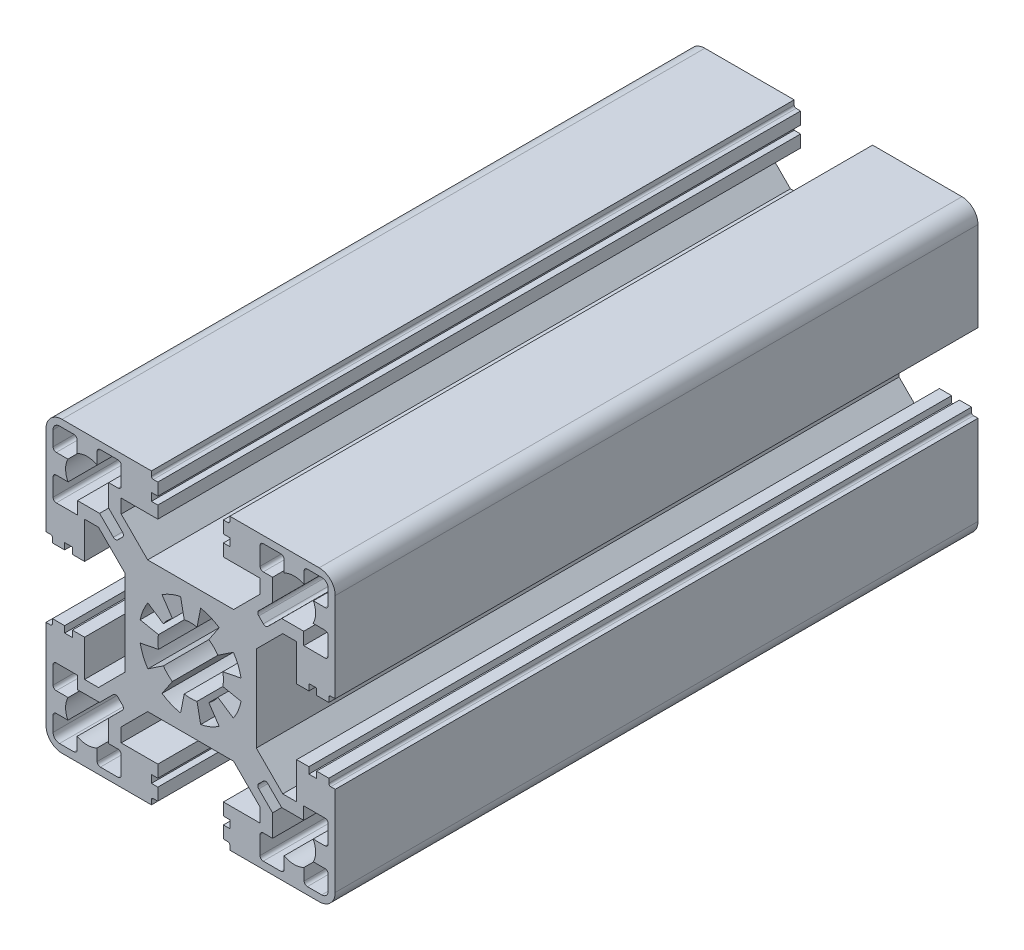
from build123d import *

# Parameters (mm, degrees)
EXTRUDE_1_DEPTH = 100


with BuildPart() as part:
    # 草图1 → 凸台-拉伸1 (new body)
    with BuildSketch(Plane.XY):
        with BuildLine():
            Line((-5.371587854, 23.257012623), (-19.271587854, 23.257012623))
            ThreePointArc((-19.271587854, 23.257012623), (-21.039354807, 22.524779576), (-21.771587854, 20.757012623))
            Line((-21.771587854, 20.757012623), (-21.771587854, 6.857012623))
            Line((-21.771587854, 6.857012623), (-21.071587854, 6.857012623))
            ThreePointArc((-21.071587854, 6.857012623), (-20.85945582, 6.769144657), (-20.771587854, 6.557012623))
            Line((-20.771587854, 6.557012623), (-20.771587854, 5.857012623))
            Line((-20.771587854, 5.857012623), (-18.871587854, 5.857012623))
            Line((-18.871587854, 5.857012623), (-18.871587854, 6.857012623))
            Line((-18.871587854, 6.857012623), (-17.671587854, 6.857012623))
            Line((-17.671587854, 6.857012623), (-17.671587854, 5.857012623))
            Line((-17.671587854, 5.857012623), (-15.771587854, 5.857012623))
            Line((-15.771587854, 5.857012623), (-15.771587854, 11.557012623))
            Line((-15.771587854, 11.557012623), (-13.60712176, 11.557012623))
            Line((-13.60712176, 11.557012623), (-9.491587854, 7.441478717))
            Line((-9.491587854, 7.441478717), (-9.491587854, -5.927453471))
            Line((-9.491587854, -5.927453471), (-13.60712176, -10.042987377))
            Line((-13.60712176, -10.042987377), (-15.771587854, -10.042987377))
            Line((-15.771587854, -10.042987377), (-15.771587854, -4.342987377))
            Line((-15.771587854, -4.342987377), (-17.671587854, -4.342987377))
            Line((-17.671587854, -4.342987377), (-17.671587854, -5.342987377))
            Line((-17.671587854, -5.342987377), (-18.871587854, -5.342987377))
            Line((-18.871587854, -5.342987377), (-18.871587854, -4.342987377))
            Line((-18.871587854, -4.342987377), (-20.771587854, -4.342987377))
            Line((-20.771587854, -4.342987377), (-20.771587854, -5.042987377))
            ThreePointArc((-20.771587854, -5.042987377), (-20.85945582, -5.255119412), (-21.071587854, -5.342987377))
            Line((-21.071587854, -5.342987377), (-21.771587854, -5.342987377))
            Line((-21.771587854, -5.342987377), (-21.771587854, -19.242987377))
            ThreePointArc((-21.771587854, -19.242987377), (-21.039354807, -21.01075433), (-19.271587854, -21.742987377))
            Line((-19.271587854, -21.742987377), (-5.371587854, -21.742987377))
            Line((-5.371587854, -21.742987377), (-5.371587854, -21.042987377))
            ThreePointArc((-5.371587854, -21.042987377), (-5.283719889, -20.830855343), (-5.071587854, -20.742987377))
            Line((-5.071587854, -20.742987377), (-4.371587854, -20.742987377))
            Line((-4.371587854, -20.742987377), (-4.371587854, -18.842987377))
            Line((-4.371587854, -18.842987377), (-5.371587854, -18.842987377))
            Line((-5.371587854, -18.842987377), (-5.371587854, -17.642987377))
            Line((-5.371587854, -17.642987377), (-4.371587854, -17.642987377))
            Line((-4.371587854, -17.642987377), (-4.371587854, -15.742987377))
            Line((-4.371587854, -15.742987377), (-10.071587854, -15.742987377))
            Line((-10.071587854, -15.742987377), (-10.071587854, -13.578521283))
            Line((-10.071587854, -13.578521283), (-5.956053948, -9.462987377))
            Line((-5.956053948, -9.462987377), (7.41287824, -9.462987377))
            Line((7.41287824, -9.462987377), (11.528412146, -13.578521283))
            Line((11.528412146, -13.578521283), (11.528412146, -15.742987377))
            Line((11.528412146, -15.742987377), (5.828412146, -15.742987377))
            Line((5.828412146, -15.742987377), (5.828412146, -17.642987377))
            Line((5.828412146, -17.642987377), (6.828412146, -17.642987377))
            Line((6.828412146, -17.642987377), (6.828412146, -18.842987377))
            Line((6.828412146, -18.842987377), (5.828412146, -18.842987377))
            Line((5.828412146, -18.842987377), (5.828412146, -20.742987377))
            Line((5.828412146, -20.742987377), (6.528412146, -20.742987377))
            ThreePointArc((6.528412146, -20.742987377), (6.74054418, -20.830855343), (6.828412146, -21.042987377))
            Line((6.828412146, -21.042987377), (6.828412146, -21.742987377))
            Line((6.828412146, -21.742987377), (20.728412146, -21.742987377))
            ThreePointArc((20.728412146, -21.742987377), (22.496179099, -21.01075433), (23.228412146, -19.242987377))
            Line((23.228412146, -19.242987377), (23.228412146, -5.342987377))
            Line((23.228412146, -5.342987377), (22.528412146, -5.342987377))
            ThreePointArc((22.528412146, -5.342987377), (22.316280111, -5.255119412), (22.228412146, -5.042987377))
            Line((22.228412146, -5.042987377), (22.228412146, -4.342987377))
            Line((22.228412146, -4.342987377), (20.328412146, -4.342987377))
            Line((20.328412146, -4.342987377), (20.328412146, -5.342987377))
            Line((20.328412146, -5.342987377), (19.128412146, -5.342987377))
            Line((19.128412146, -5.342987377), (19.128412146, -4.342987377))
            Line((19.128412146, -4.342987377), (17.228412146, -4.342987377))
            Line((17.228412146, -4.342987377), (17.228412146, -10.042987377))
            Line((17.228412146, -10.042987377), (15.063946052, -10.042987377))
            Line((15.063946052, -10.042987377), (10.948412146, -5.927453471))
            Line((10.948412146, -5.927453471), (10.948412146, 7.441478717))
            Line((10.948412146, 7.441478717), (15.063946052, 11.557012623))
            Line((15.063946052, 11.557012623), (17.228412146, 11.557012623))
            Line((17.228412146, 11.557012623), (17.228412146, 5.857012623))
            Line((17.228412146, 5.857012623), (19.128412146, 5.857012623))
            Line((19.128412146, 5.857012623), (19.128412146, 6.857012623))
            Line((19.128412146, 6.857012623), (20.328412146, 6.857012623))
            Line((20.328412146, 6.857012623), (20.328412146, 5.857012623))
            Line((20.328412146, 5.857012623), (22.228412146, 5.857012623))
            Line((22.228412146, 5.857012623), (22.228412146, 6.557012623))
            ThreePointArc((22.228412146, 6.557012623), (22.316280111, 6.769144657), (22.528412146, 6.857012623))
            Line((22.528412146, 6.857012623), (23.228412146, 6.857012623))
            Line((23.228412146, 6.857012623), (23.228412146, 20.757012623))
            ThreePointArc((23.228412146, 20.757012623), (22.496179099, 22.524779576), (20.728412146, 23.257012623))
            Line((20.728412146, 23.257012623), (6.828412146, 23.257012623))
            Line((6.828412146, 23.257012623), (6.828412146, 22.557012623))
            ThreePointArc((6.828412146, 22.557012623), (6.74054418, 22.344880588), (6.528412146, 22.257012623))
            Line((6.528412146, 22.257012623), (5.828412146, 22.257012623))
            Line((5.828412146, 22.257012623), (5.828412146, 20.357012623))
            Line((5.828412146, 20.357012623), (6.828412146, 20.357012623))
            Line((6.828412146, 20.357012623), (6.828412146, 19.157012623))
            Line((6.828412146, 19.157012623), (5.828412146, 19.157012623))
            Line((5.828412146, 19.157012623), (5.828412146, 17.257012623))
            Line((5.828412146, 17.257012623), (11.528412146, 17.257012623))
            Line((11.528412146, 17.257012623), (11.528412146, 15.092546529))
            Line((11.528412146, 15.092546529), (7.41287824, 10.977012623))
            Line((7.41287824, 10.977012623), (-5.956053948, 10.977012623))
            Line((-5.956053948, 10.977012623), (-10.071587854, 15.092546529))
            Line((-10.071587854, 15.092546529), (-10.071587854, 17.257012623))
            Line((-10.071587854, 17.257012623), (-4.371587854, 17.257012623))
            Line((-4.371587854, 17.257012623), (-4.371587854, 19.157012623))
            Line((-4.371587854, 19.157012623), (-5.371587854, 19.157012623))
            Line((-5.371587854, 19.157012623), (-5.371587854, 20.357012623))
            Line((-5.371587854, 20.357012623), (-4.371587854, 20.357012623))
            Line((-4.371587854, 20.357012623), (-4.371587854, 22.257012623))
            Line((-4.371587854, 22.257012623), (-5.071587854, 22.257012623))
            ThreePointArc((-5.071587854, 22.257012623), (-5.283719889, 22.344880588), (-5.371587854, 22.557012623))
            Line((-5.371587854, 22.557012623), (-5.371587854, 23.257012623))
        make_face()
        with BuildLine():
            Line((-3.716149718, -5.894744276), (-2.104996043, -3.4834824))
            ThreePointArc((-2.104996043, -3.4834824), (-2.877832438, -2.849231961), (-3.512082877, -2.076395566))
            Line((-3.512082877, -2.076395566), (-5.923344753, -3.687549241))
            ThreePointArc((-5.923344753, -3.687549241), (-6.662624114, -2.304454836), (-7.117870097, -0.803709953))
            Line((-7.117870097, -0.803709953), (-4.273592784, -0.23794802))
            ThreePointArc((-4.273592784, -0.23794802), (-4.371587854, 0.757012623), (-4.273592784, 1.751973265))
            Line((-4.273592784, 1.751973265), (-7.117870097, 2.317735199))
            ThreePointArc((-7.117870097, 2.317735199), (-6.662624114, 3.818480082), (-5.923344753, 5.201574487))
            Line((-5.923344753, 5.201574487), (-3.512082877, 3.590420811))
            ThreePointArc((-3.512082877, 3.590420811), (-2.877832438, 4.363257207), (-2.104996043, 4.997507645))
            Line((-2.104996043, 4.997507645), (-3.716149718, 7.408769521))
            ThreePointArc((-3.716149718, 7.408769521), (-2.333055313, 8.148048883), (-0.83231043, 8.603294866))
            Line((-0.83231043, 8.603294866), (-0.266548496, 5.759017553))
            ThreePointArc((-0.266548496, 5.759017553), (0.728412146, 5.857012623), (1.723372788, 5.759017553))
            Line((1.723372788, 5.759017553), (2.289134722, 8.603294866))
            ThreePointArc((2.289134722, 8.603294866), (3.789879605, 8.148048883), (5.17297401, 7.408769521))
            Line((5.17297401, 7.408769521), (3.561820334, 4.997507645))
            ThreePointArc((3.561820334, 4.997507645), (4.33465673, 4.363257207), (4.968907169, 3.590420811))
            Line((4.968907169, 3.590420811), (7.380169044, 5.201574487))
            ThreePointArc((7.380169044, 5.201574487), (8.119448406, 3.818480082), (8.574694389, 2.317735199))
            Line((8.574694389, 2.317735199), (5.730417076, 1.751973265))
            ThreePointArc((5.730417076, 1.751973265), (5.828412146, 0.757012623), (5.730417076, -0.23794802))
            Line((5.730417076, -0.23794802), (8.574694389, -0.803709953))
            ThreePointArc((8.574694389, -0.803709953), (8.119448406, -2.304454836), (7.380169044, -3.687549241))
            Line((7.380169044, -3.687549241), (4.968907169, -2.076395566))
            ThreePointArc((4.968907169, -2.076395566), (4.33465673, -2.849231961), (3.561820334, -3.4834824))
            Line((3.561820334, -3.4834824), (5.17297401, -5.894744276))
            ThreePointArc((5.17297401, -5.894744276), (3.789879605, -6.634023637), (2.289134722, -7.089269621))
            Line((2.289134722, -7.089269621), (1.723372788, -4.244992307))
            ThreePointArc((1.723372788, -4.244992307), (0.728412146, -4.342987377), (-0.266548496, -4.244992307))
            Line((-0.266548496, -4.244992307), (-0.83231043, -7.089269621))
            ThreePointArc((-0.83231043, -7.089269621), (-2.333055313, -6.634023637), (-3.716149718, -5.894744276))
        make_face(mode=Mode.SUBTRACT)
        with BuildLine():
            Line((-20.671587854, 21.157012623), (-20.671587854, 18.857012623))
            ThreePointArc((-20.671587854, 18.857012623), (-20.525141245, 18.503459232), (-20.171587854, 18.357012623))
            Line((-20.171587854, 18.357012623), (-18.367001014, 18.357012623))
            ThreePointArc((-18.367001014, 18.357012623), (-18.721418112, 16.823289618), (-18.336195754, 15.297012623))
            Line((-18.336195754, 15.297012623), (-20.171587854, 15.297012623))
            ThreePointArc((-20.171587854, 15.297012623), (-20.525141245, 15.150566013), (-20.671587854, 14.797012623))
            Line((-20.671587854, 14.797012623), (-20.671587854, 12.057012623))
            ThreePointArc((-20.671587854, 12.057012623), (-20.525141245, 11.703459232), (-20.171587854, 11.557012623))
            Line((-20.171587854, 11.557012623), (-16.871587854, 11.557012623))
            Line((-16.871587854, 11.557012623), (-16.871587854, 13.507012623))
            Line((-16.871587854, 13.507012623), (-13.435801417, 13.507012623))
            Line((-13.435801417, 13.507012623), (-11.292403135, 11.363614341))
            ThreePointArc((-11.292403135, 11.363614341), (-10.938849744, 11.217167731), (-10.585296353, 11.363614342))
            Line((-10.585296353, 11.363614342), (-9.878189571, 12.070721124))
            ThreePointArc((-9.878189571, 12.070721124), (-9.731742961, 12.424274514), (-9.878189571, 12.777827905))
            Line((-9.878189571, 12.777827905), (-12.021587851, 14.921226185))
            Line((-12.021587851, 14.921226185), (-12.021587851, 18.357012623))
            Line((-12.021587851, 18.357012623), (-10.571587854, 18.357012623))
            ThreePointArc((-10.571587854, 18.357012623), (-10.218034464, 18.503459232), (-10.071587854, 18.857012623))
            Line((-10.071587854, 18.857012623), (-10.071587854, 21.657012623))
            ThreePointArc((-10.071587854, 21.657012623), (-10.218034464, 22.010566013), (-10.571587854, 22.157012623))
            Line((-10.571587854, 22.157012623), (-13.311587854, 22.157012623))
            ThreePointArc((-13.311587854, 22.157012623), (-13.665141245, 22.010566013), (-13.811587854, 21.657012623))
            Line((-13.811587854, 21.657012623), (-13.811587854, 19.821620523))
            ThreePointArc((-13.811587854, 19.821620523), (-15.371587854, 20.207012623), (-16.931587854, 19.821620523))
            Line((-16.931587854, 19.821620523), (-16.931587854, 21.657012623))
            ThreePointArc((-16.931587854, 21.657012623), (-17.078034464, 22.010566013), (-17.431587854, 22.157012623))
            Line((-17.431587854, 22.157012623), (-19.671587854, 22.157012623))
            ThreePointArc((-19.671587854, 22.157012623), (-20.378694635, 21.864119404), (-20.671587854, 21.157012623))
        make_face(mode=Mode.SUBTRACT)
        with BuildLine():
            Line((13.478412146, 18.357012623), (12.028412146, 18.357012623))
            ThreePointArc((12.028412146, 18.357012623), (11.674858755, 18.503459232), (11.528412146, 18.857012623))
            Line((11.528412146, 18.857012623), (11.528412146, 21.657012623))
            ThreePointArc((11.528412146, 21.657012623), (11.674858755, 22.010566013), (12.028412146, 22.157012623))
            Line((12.028412146, 22.157012623), (14.768412146, 22.157012623))
            ThreePointArc((14.768412146, 22.157012623), (15.121965536, 22.010566013), (15.268412146, 21.657012623))
            Line((15.268412146, 21.657012623), (15.268412146, 19.821620523))
            ThreePointArc((15.268412146, 19.821620523), (16.828412146, 20.207012623), (18.388412146, 19.821620523))
            Line((18.388412146, 19.821620523), (18.388412146, 21.657012623))
            ThreePointArc((18.388412146, 21.657012623), (18.534858755, 22.010566013), (18.888412146, 22.157012623))
            Line((18.888412146, 22.157012623), (21.128412146, 22.157012623))
            ThreePointArc((21.128412146, 22.157012623), (21.835518927, 21.864119404), (22.128412146, 21.157012623))
            Line((22.128412146, 21.157012623), (22.128412146, 18.857012623))
            ThreePointArc((22.128412146, 18.857012623), (21.981965536, 18.503459232), (21.628412146, 18.357012623))
            Line((21.628412146, 18.357012623), (19.823825306, 18.357012623))
            ThreePointArc((19.823825306, 18.357012623), (20.178242404, 16.823289618), (19.793020046, 15.297012623))
            Line((19.793020046, 15.297012623), (21.628412146, 15.297012623))
            ThreePointArc((21.628412146, 15.297012623), (21.981965536, 15.150566013), (22.128412146, 14.797012623))
            Line((22.128412146, 14.797012623), (22.128412146, 12.057012623))
            ThreePointArc((22.128412146, 12.057012623), (21.981965536, 11.703459232), (21.628412146, 11.557012623))
            Line((21.628412146, 11.557012623), (18.328412146, 11.557012623))
            Line((18.328412146, 11.557012623), (18.328412146, 13.507012623))
            Line((18.328412146, 13.507012623), (14.892625712, 13.507012623))
            Line((14.892625712, 13.507012623), (12.74922743, 11.363614341))
            ThreePointArc((12.74922743, 11.363614341), (12.395674038, 11.217167731), (12.042120648, 11.363614342))
            Line((12.042120648, 11.363614342), (11.335013866, 12.070721124))
            ThreePointArc((11.335013866, 12.070721124), (11.188567256, 12.424274514), (11.335013866, 12.777827905))
            Line((11.335013866, 12.777827905), (13.478412146, 14.921226185))
            Line((13.478412146, 14.921226185), (13.478412146, 18.357012623))
        make_face(mode=Mode.SUBTRACT)
        with BuildLine():
            Line((-12.021587851, -16.817992725), (-10.571587854, -16.817992725))
            ThreePointArc((-10.571587854, -16.817992725), (-10.218034464, -16.964439334), (-10.071587854, -17.317992725))
            Line((-10.071587854, -17.317992725), (-10.071587854, -20.117992725))
            ThreePointArc((-10.071587854, -20.117992725), (-10.218034464, -20.471546116), (-10.571587854, -20.617992725))
            Line((-10.571587854, -20.617992725), (-13.311587854, -20.617992725))
            ThreePointArc((-13.311587854, -20.617992725), (-13.665141245, -20.471546116), (-13.811587854, -20.117992725))
            Line((-13.811587854, -20.117992725), (-13.811587854, -18.282600625))
            ThreePointArc((-13.811587854, -18.282600625), (-15.371587854, -18.667992725), (-16.931587854, -18.282600625))
            Line((-16.931587854, -18.282600625), (-16.931587854, -20.117992725))
            ThreePointArc((-16.931587854, -20.117992725), (-17.078034464, -20.471546116), (-17.431587854, -20.617992725))
            Line((-17.431587854, -20.617992725), (-19.671587854, -20.617992725))
            ThreePointArc((-19.671587854, -20.617992725), (-20.378694635, -20.325099506), (-20.671587854, -19.617992725))
            Line((-20.671587854, -19.617992725), (-20.671587854, -17.317992725))
            ThreePointArc((-20.671587854, -17.317992725), (-20.525141245, -16.964439334), (-20.171587854, -16.817992725))
            Line((-20.171587854, -16.817992725), (-18.367001014, -16.817992725))
            ThreePointArc((-18.367001014, -16.817992725), (-18.721418112, -15.284269721), (-18.336195754, -13.757992725))
            Line((-18.336195754, -13.757992725), (-20.171587854, -13.757992725))
            ThreePointArc((-20.171587854, -13.757992725), (-20.525141245, -13.611546116), (-20.671587854, -13.257992725))
            Line((-20.671587854, -13.257992725), (-20.671587854, -10.517992725))
            ThreePointArc((-20.671587854, -10.517992725), (-20.525141245, -10.164439334), (-20.171587854, -10.017992725))
            Line((-20.171587854, -10.017992725), (-16.871587854, -10.017992725))
            Line((-16.871587854, -10.017992725), (-16.871587854, -11.967992725))
            Line((-16.871587854, -11.967992725), (-13.435801417, -11.967992725))
            Line((-13.435801417, -11.967992725), (-11.292403135, -9.824594443))
            ThreePointArc((-11.292403135, -9.824594443), (-10.938849743, -9.678147834), (-10.585296353, -9.824594444))
            Line((-10.585296353, -9.824594444), (-9.878189571, -10.531701226))
            ThreePointArc((-9.878189571, -10.531701226), (-9.731742961, -10.885254617), (-9.878189571, -11.238808007))
            Line((-9.878189571, -11.238808007), (-12.021587851, -13.382206287))
            Line((-12.021587851, -13.382206287), (-12.021587851, -16.817992725))
        make_face(mode=Mode.SUBTRACT)
        with BuildLine():
            Line((13.478412146, -16.817992725), (12.028412146, -16.817992725))
            ThreePointArc((12.028412146, -16.817992725), (11.674858755, -16.964439334), (11.528412146, -17.317992725))
            Line((11.528412146, -17.317992725), (11.528412146, -20.117992725))
            ThreePointArc((11.528412146, -20.117992725), (11.674858755, -20.471546116), (12.028412146, -20.617992725))
            Line((12.028412146, -20.617992725), (14.768412146, -20.617992725))
            ThreePointArc((14.768412146, -20.617992725), (15.121965536, -20.471546116), (15.268412146, -20.117992725))
            Line((15.268412146, -20.117992725), (15.268412146, -18.282600625))
            ThreePointArc((15.268412146, -18.282600625), (16.828412146, -18.667992725), (18.388412146, -18.282600625))
            Line((18.388412146, -18.282600625), (18.388412146, -20.117992725))
            ThreePointArc((18.388412146, -20.117992725), (18.534858755, -20.471546116), (18.888412146, -20.617992725))
            Line((18.888412146, -20.617992725), (21.128412146, -20.617992725))
            ThreePointArc((21.128412146, -20.617992725), (21.835518927, -20.325099506), (22.128412146, -19.617992725))
            Line((22.128412146, -19.617992725), (22.128412146, -17.317992725))
            ThreePointArc((22.128412146, -17.317992725), (21.981965536, -16.964439334), (21.628412146, -16.817992725))
            Line((21.628412146, -16.817992725), (19.823825306, -16.817992725))
            ThreePointArc((19.823825306, -16.817992725), (20.178242404, -15.284269721), (19.793020046, -13.757992725))
            Line((19.793020046, -13.757992725), (21.628412146, -13.757992725))
            ThreePointArc((21.628412146, -13.757992725), (21.981965536, -13.611546116), (22.128412146, -13.257992725))
            Line((22.128412146, -13.257992725), (22.128412146, -10.517992725))
            ThreePointArc((22.128412146, -10.517992725), (21.981965536, -10.164439334), (21.628412146, -10.017992725))
            Line((21.628412146, -10.017992725), (18.328412149, -10.017992725))
            Line((18.328412149, -10.017992725), (18.328412149, -11.967992725))
            Line((18.328412149, -11.967992725), (14.892625712, -11.967992725))
            Line((14.892625712, -11.967992725), (12.74922743, -9.824594443))
            ThreePointArc((12.74922743, -9.824594443), (12.395674038, -9.678147834), (12.042120648, -9.824594444))
            Line((12.042120648, -9.824594444), (11.335013866, -10.531701226))
            ThreePointArc((11.335013866, -10.531701226), (11.188567256, -10.885254617), (11.335013866, -11.238808007))
            Line((11.335013866, -11.238808007), (13.478412146, -13.382206287))
            Line((13.478412146, -13.382206287), (13.478412146, -16.817992725))
        make_face(mode=Mode.SUBTRACT)
    extrude(amount=EXTRUDE_1_DEPTH)


solid = part.part
